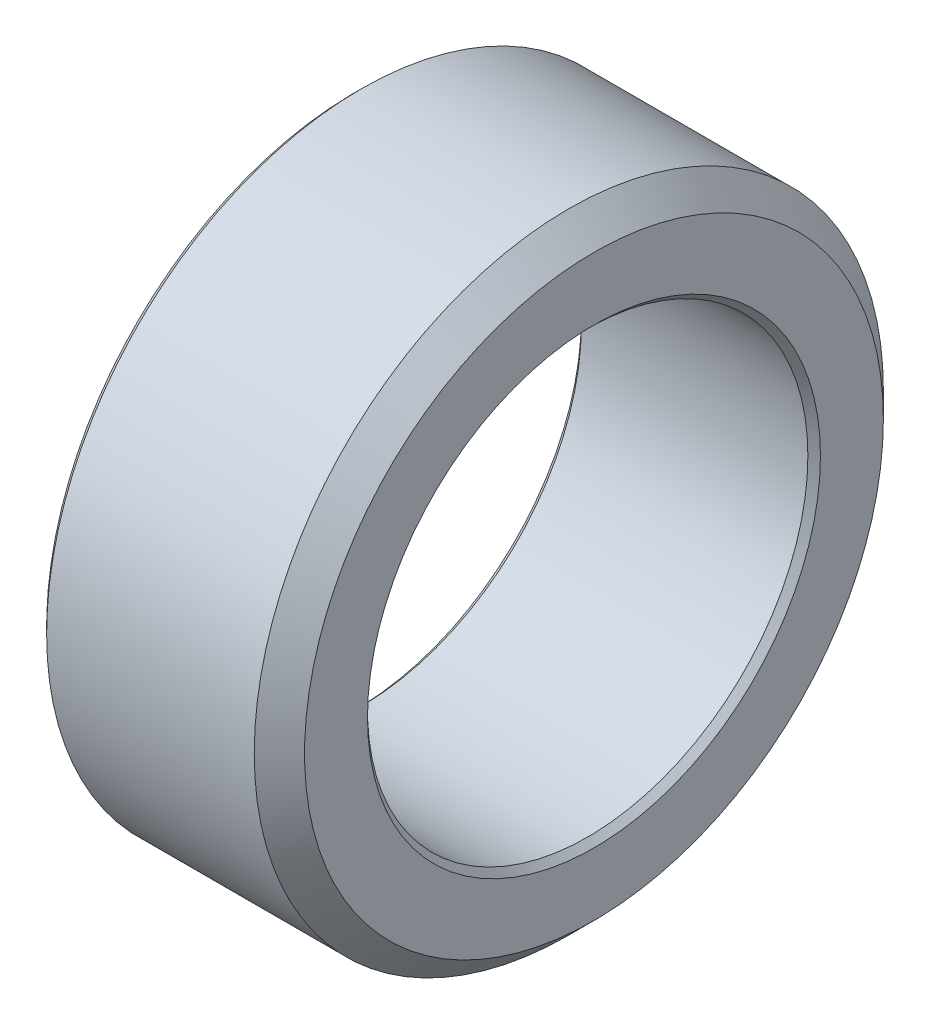
from build123d import *

# Parameters (mm, degrees)
SKETCH_1_R      = 50
SKETCH_1_R_2    = 35
EXTRUDE_1_DEPTH = 38
CHAMFER_1_SIZE  = 1
CHAMFER_2_SIZE  = 4


with BuildPart() as part:
    # 草图1 → 凸台-拉伸1 (new body)
    with BuildSketch(Plane(origin=(0, 0, 0), x_dir=(0, 0, -1), z_dir=(1, 0, 0))):
        Circle(SKETCH_1_R)
        Circle(SKETCH_1_R_2, mode=Mode.SUBTRACT)
    extrude(amount=EXTRUDE_1_DEPTH)

    # 倒角1
    chamfer_1_edges = [part.edges().sort_by_distance(p)[0] for p in [
        (0, 0, 50),
        (0, 0, 35),
        (38, 0, 35),
    ]]
    chamfer(chamfer_1_edges, length=CHAMFER_1_SIZE)

    # 倒角2
    chamfer_2_edges = [part.edges().sort_by_distance(p)[0] for p in [
        (38, 0, 50),
    ]]
    chamfer(chamfer_2_edges, length=CHAMFER_2_SIZE)


solid = part.part
